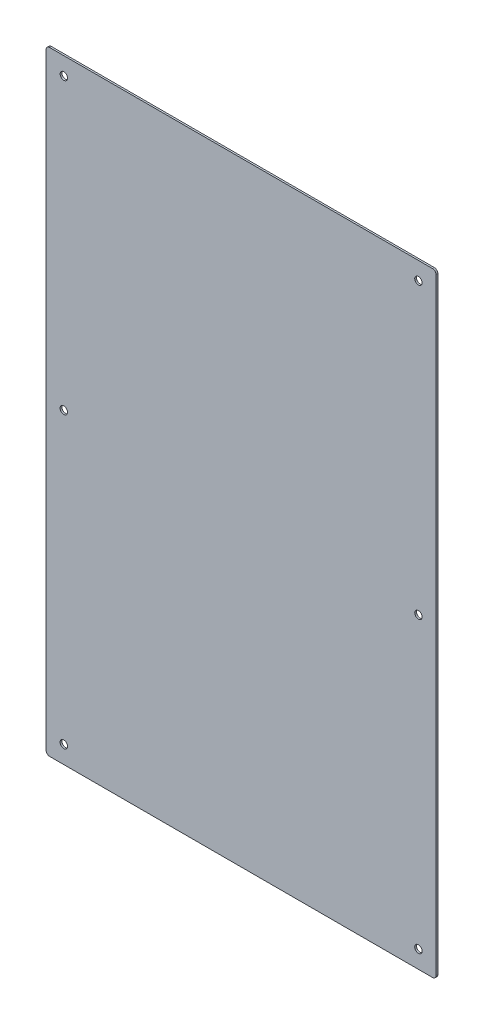
from build123d import *

# Parameters (mm, degrees)
SKETCH_1_R      = 2.1
EXTRUDE_1_DEPTH = 1


with BuildPart() as part:
    # Эскиз1 → Вытянуть1 (new body)
    with BuildSketch(Plane.XY):
        with BuildLine():
            Line((-108.5, -174), (108.5, -174))
            ThreePointArc((108.5, -174), (109.914213562, -173.414213562), (110.5, -172))
            Line((110.5, -172), (110.5, 172))
            ThreePointArc((110.5, 172), (109.914213562, 173.414213562), (108.5, 174))
            Line((108.5, 174), (-108.5, 174))
            ThreePointArc((-108.5, 174), (-109.914213562, 173.414213562), (-110.5, 172))
            Line((-110.5, 172), (-110.5, -172))
            ThreePointArc((-110.5, -172), (-109.914213562, -173.414213562), (-108.5, -174))
        make_face()
        with Locations((-100.5, 164)):
            Circle(SKETCH_1_R, mode=Mode.SUBTRACT)
        with Locations((-100.5, 0)):
            Circle(SKETCH_1_R, mode=Mode.SUBTRACT)
        with Locations(Location((-100.5, -164, 0), (0, 0, 180))):
            Circle(SKETCH_1_R, mode=Mode.SUBTRACT)
        with Locations((100.5, -164)):
            Circle(SKETCH_1_R, mode=Mode.SUBTRACT)
        with Locations(Location((100.5, 0, 0), (0, 0, 180))):
            Circle(SKETCH_1_R, mode=Mode.SUBTRACT)
        with Locations(Location((100.5, 164, 0), (0, 0, 180))):
            Circle(SKETCH_1_R, mode=Mode.SUBTRACT)
    extrude(amount=EXTRUDE_1_DEPTH)


solid = part.part
